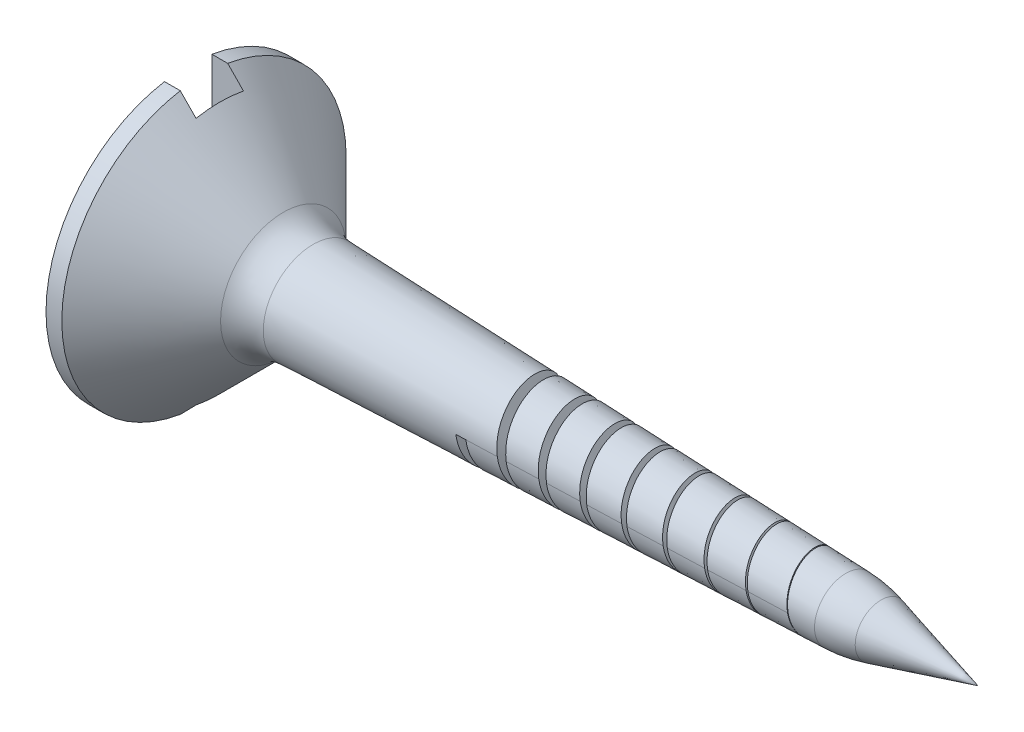
from build123d import *

# Parameters (mm, degrees)
SWEEP_1_PITCH       = 2.5
SWEEP_1_HEIGHT      = 30
SWEEP_1_RADIUS      = 2
SKETCH_4_W          = 2
SKETCH_4_H          = 3
CUT_EXTRUDE_1_DEPTH = 15


with BuildPart() as part:
    # 草图1 → 旋转2 (revolve)
    with BuildSketch(Plane.XY, mode=Mode.PRIVATE) as revolve_2_sk:
        with BuildLine():
            Line((-23.292706115, 0), (26.707293885, 0))
            Line((26.707293885, 0), (20.57596758, 1.642883932))
            ThreePointArc((20.57596758, 1.642883932), (19.46587124, 1.873784303), (18.336772096, 1.977533939))
            Line((18.336772096, 1.977533939), (-15.382502881, 3.155036968))
            ThreePointArc((-15.382502881, 3.155036968), (-16.402675254, 3.385878408), (-17.26725788, 3.974551766))
            Line((-17.26725788, 3.974551766), (-22.292706115, 9))
            Line((-22.292706115, 9), (-23.292706115, 9))
            Line((-23.292706115, 9), (-23.292706115, 0))
        make_face()
    revolve(revolve_2_sk.sketch.rotate(Axis((-23.292706115, 0, 0), (1, 0, 0)), 90), axis=Axis((-23.292706115, 0, 0), (1, 0, 0)))

    # 切除-扫描1: sweep along a helix
    with BuildLine() as sweep_1_path:
        Helix(SWEEP_1_PITCH, SWEEP_1_HEIGHT, SWEEP_1_RADIUS, center=(-3.292706115, 0, 0), direction=(1, 0, 0))
    # 草图3 → 切除-扫描1 (sweep, cut)
    with BuildSketch(Plane(origin=(0, 0, 0), x_dir=(1, 0, 0), z_dir=(0, 1, 0))):
        Polygon((-3.292706115, -1.988926668), (-3.783246679, -3.173196351), (-2.802165551, -3.173196351), align=None)
    sweep(path=sweep_1_path.line, is_frenet=True, mode=Mode.SUBTRACT)

    # 草图4 → 切除-拉伸1 (cut, symmetric)
    with BuildSketch(Plane(origin=(0, 0, 0), x_dir=(1, 0, 0), z_dir=(0, 1, 0))):
        with Locations((-22.292706115, 0)):
            Rectangle(SKETCH_4_W, SKETCH_4_H)
    extrude(amount=CUT_EXTRUDE_1_DEPTH, both=True, mode=Mode.SUBTRACT)


solid = part.part
